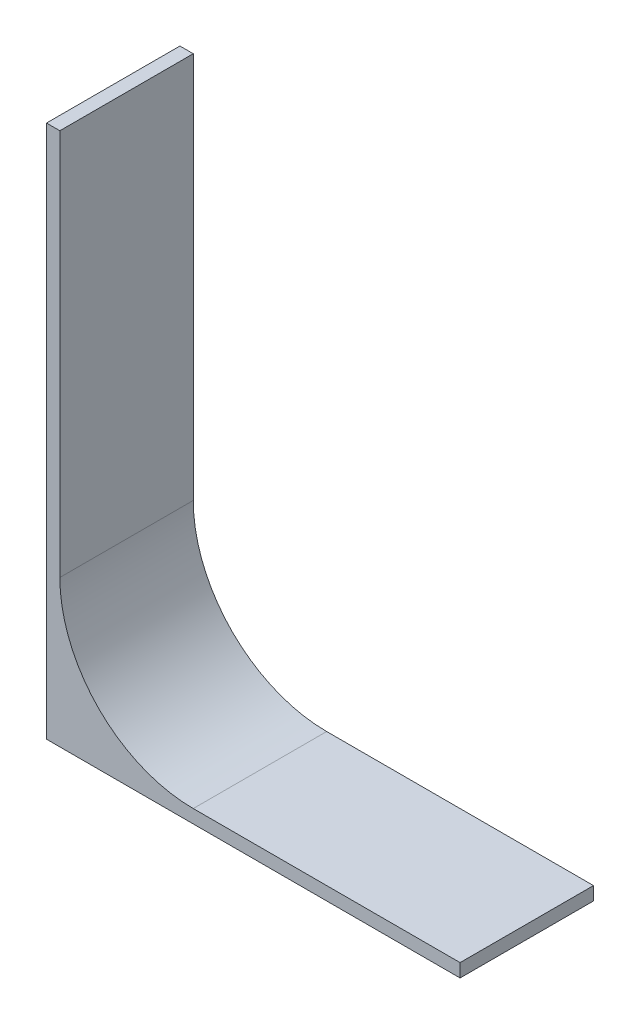
from build123d import *

# Parameters (mm, degrees)
SKETCH1_W           = 30
SKETCH1_H           = 10
BOSS_EXTRUDE1_DEPTH = 1
SKETCH4_W           = 10
SKETCH4_H           = 40
BOSS_EXTRUDE2_DEPTH = 1
FILLET2_R           = 10


with BuildPart() as part:
    # Sketch1 → Boss-Extrude1 (new body)
    with BuildSketch(Plane(origin=(0, 0, 0), x_dir=(1, 0, 0), z_dir=(0, 1, 0))):
        with Locations((15, 5)):
            Rectangle(SKETCH1_W, SKETCH1_H)
    extrude(amount=BOSS_EXTRUDE1_DEPTH)

    # Sketch4 → Boss-Extrude2 (add)
    with BuildSketch(Plane(origin=(0, 0, 0), x_dir=(0, 0, -1), z_dir=(1, 0, 0))):
        with Locations((5, 20)):
            Rectangle(SKETCH4_W, SKETCH4_H)
    extrude(amount=-BOSS_EXTRUDE2_DEPTH)

    # Fillet2
    fillet2_edges = [part.edges().sort_by_distance(p)[0] for p in [
        (0, 1, -5),
    ]]
    fillet(fillet2_edges, radius=FILLET2_R)


solid = part.part
